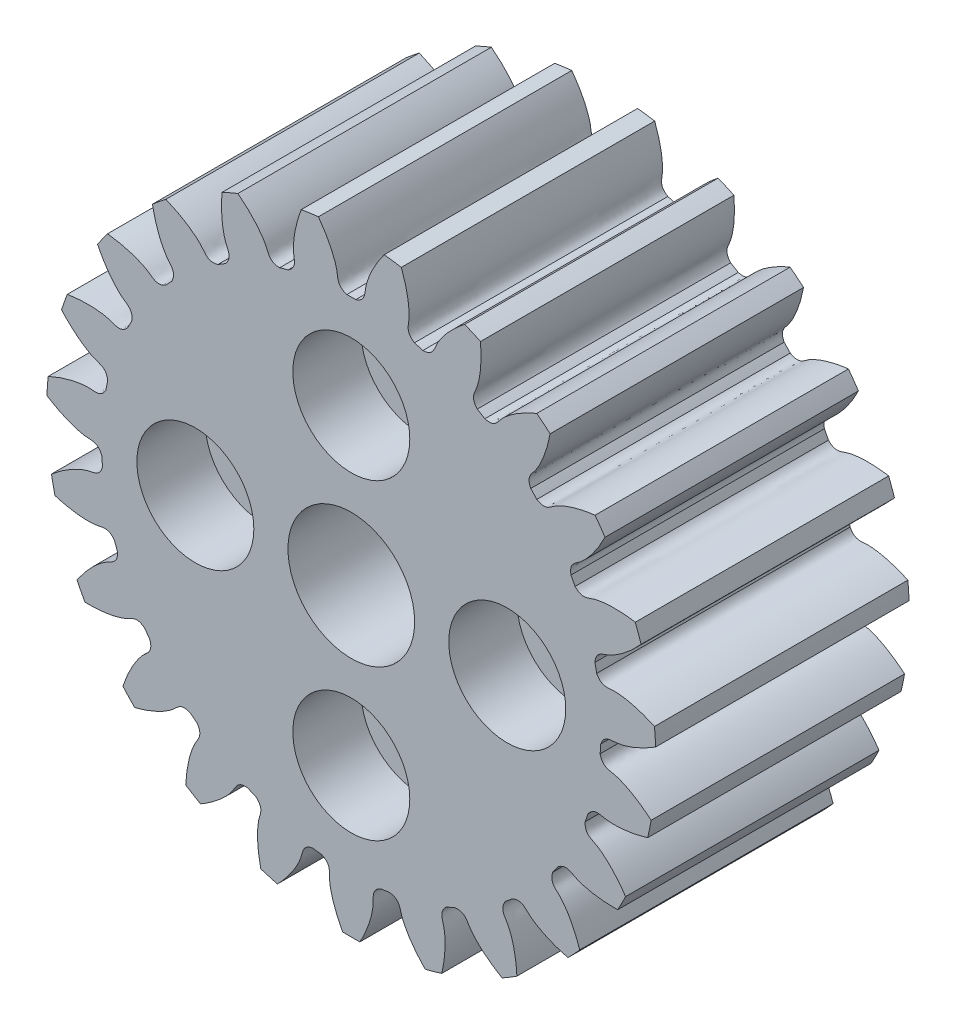
from build123d import *

# Parameters (mm, degrees)
SKETCH_1_R               = 15.625
EXTRUDE_1_DEPTH          = 13
CUT_EXTRUDE_1_DEPTH      = 26.637496953
PATTERN_CIRCULAR_1_COUNT = 23
SKETCH_4_R               = 3.25
SKETCH_4_R_2             = 1.6
CUT_EXTRUDE_2_DEPTH      = 26.629916026
SKETCH_5_R               = 3
CUT_EXTRUDE_3_DEPTH      = 3.5


with BuildPart() as part:
    # 草图1 → 凸台-拉伸1 (new body)
    with BuildSketch(Plane.XY):
        Circle(SKETCH_1_R)
    extrude(amount=EXTRUDE_1_DEPTH)

    # 草图2 → 切除-拉伸1 (cut, through all)
    with BuildSketch(Plane.XY):
        with BuildLine():
            ThreePointArc((0.226722066, 12.810493876), (0, 12.8125), (-0.226722066, 12.810493876))
            add(Edge.make_bspline(
                [(-0.226722066, 12.810493876), (-0.722166858, 12.958453718), (-0.679700385, 13.292296463), (-0.741162418, 13.621469961), (-0.749372403, 13.66115581), (-0.759577599, 13.705937526), (-0.771976986, 13.755750741), (-0.786777808, 13.810522977), (-0.804182039, 13.870176188), (-0.824390453, 13.934626027), (-0.847601146, 14.003782149), (-0.874009771, 14.077548195), (-0.903809262, 14.155821886), (-0.937189708, 14.23849508), (-0.974338188, 14.325453853), (-1.015438615, 14.416578576), (-1.060671588, 14.511743991), (-1.110214235, 14.610819306), (-1.164240068, 14.713668275), (-1.222918834, 14.8201493), (-1.286416372, 14.93011552), (-1.354894472, 15.043414917), (-1.428510731, 15.159890415), (-1.507418422, 15.279379994), (-1.591766354, 15.401716796), (-1.681698744, 15.52672924), (-1.777355087, 15.65424114), (-1.878870029, 15.784071829), (-1.986373245, 15.916036278), (-2.099989321, 16.049945226), (-2.219837633, 16.185605313), (-2.346032235, 16.322819205), (-2.478681751, 16.461385741), (-2.617889265, 16.601100063), (-2.763752217, 16.741753762), (-2.916362307, 16.883135021), (-3.07580539, 17.025028764), (-3.2421614, 17.167216803), (-3.415504209, 17.309477992), (-3.658864008, 17.501187679), (-3.847863067, 17.640995195), (-3.977100957, 17.73274444)],
                knots=[0, 0, 0, 0, 0.147386897, 0.152959532, 0.159389495, 0.166676786, 0.174821406, 0.183823355, 0.193682632, 0.204399237, 0.21597317, 0.228404432, 0.241693023, 0.255838942, 0.270842189, 0.286702764, 0.303420668, 0.320995901, 0.339428462, 0.358718351, 0.378865568, 0.399870114, 0.421731989, 0.444451192, 0.468027723, 0.492461582, 0.517752771, 0.543901287, 0.570907132, 0.598770305, 0.627490807, 0.657068637, 0.687503795, 0.718796282, 0.750946098, 0.783953241, 0.817817713, 0.852539514, 0.888118643, 0.9245551, 1, 1, 1, 1], degree=3))
            ThreePointArc((-3.977100957, 17.73274444), (0, 18.173264907), (3.977100957, 17.73274444))
            add(Edge.make_bspline(
                [(0.226722066, 12.810493876), (0.722166858, 12.958453718), (0.679700385, 13.292296463), (0.741162418, 13.621469961), (0.749372403, 13.66115581), (0.759577599, 13.705937526), (0.771976986, 13.755750741), (0.786777808, 13.810522977), (0.804182039, 13.870176188), (0.824390453, 13.934626027), (0.847601146, 14.003782149), (0.874009771, 14.077548195), (0.903809262, 14.155821886), (0.937189708, 14.23849508), (0.974338188, 14.325453853), (1.015438615, 14.416578576), (1.060671588, 14.511743991), (1.110214235, 14.610819306), (1.164240068, 14.713668275), (1.222918834, 14.8201493), (1.286416372, 14.93011552), (1.354894472, 15.043414917), (1.428510731, 15.159890415), (1.507418422, 15.279379994), (1.591766354, 15.401716796), (1.681698744, 15.52672924), (1.777355087, 15.65424114), (1.878870029, 15.784071829), (1.986373245, 15.916036278), (2.099989321, 16.049945226), (2.219837633, 16.185605313), (2.346032235, 16.322819205), (2.478681751, 16.461385741), (2.617889265, 16.601100063), (2.763752217, 16.741753762), (2.916362307, 16.883135021), (3.07580539, 17.025028764), (3.2421614, 17.167216803), (3.415504209, 17.309477992), (3.658864008, 17.501187679), (3.847863067, 17.640995195), (3.977100957, 17.73274444)],
                knots=[0, 0, 0, 0, 0.147386897, 0.152959532, 0.159389495, 0.166676786, 0.174821406, 0.183823355, 0.193682632, 0.204399237, 0.21597317, 0.228404432, 0.241693023, 0.255838942, 0.270842189, 0.286702764, 0.303420668, 0.320995901, 0.339428462, 0.358718351, 0.378865568, 0.399870114, 0.421731989, 0.444451192, 0.468027723, 0.492461582, 0.517752771, 0.543901287, 0.570907132, 0.598770305, 0.627490807, 0.657068637, 0.687503795, 0.718796282, 0.750946098, 0.783953241, 0.817817713, 0.852539514, 0.888118643, 0.9245551, 1, 1, 1, 1], degree=3))
        make_face()
    cut_extrude_1 = extrude(amount=CUT_EXTRUDE_1_DEPTH, mode=Mode.SUBTRACT)

    # 阵列(圆周)1: 切除-拉伸1 ×23 about axis
    pattern_circular_1_axis = Axis((0, 0, -0.65), (0, 0, 1))
    for i in range(1, PATTERN_CIRCULAR_1_COUNT):
        add(cut_extrude_1.rotate(pattern_circular_1_axis, i * 360 / PATTERN_CIRCULAR_1_COUNT), mode=Mode.SUBTRACT)

    # 草图4 → 切除-拉伸2 (cut, through all)
    with BuildSketch(Plane.XY.offset(13)):
        Circle(SKETCH_4_R)
        with Locations((0, 8)):
            Circle(SKETCH_4_R_2)
        with Locations((8, 0)):
            Circle(SKETCH_4_R_2)
        with Locations((0, -8)):
            Circle(SKETCH_4_R_2)
        with Locations((-8, 0)):
            Circle(SKETCH_4_R_2)
    extrude(amount=-CUT_EXTRUDE_2_DEPTH, mode=Mode.SUBTRACT)

    # 草图5 → 切除-拉伸3 (cut)
    with BuildSketch(Plane.XY.offset(13)):
        with Locations((0, 8)):
            Circle(SKETCH_5_R)
        with Locations((8, 0)):
            Circle(SKETCH_5_R)
        with Locations((0, -8)):
            Circle(SKETCH_5_R)
        with Locations((-8, 0)):
            Circle(SKETCH_5_R)
    extrude(amount=-CUT_EXTRUDE_3_DEPTH, mode=Mode.SUBTRACT)


solid = part.part
